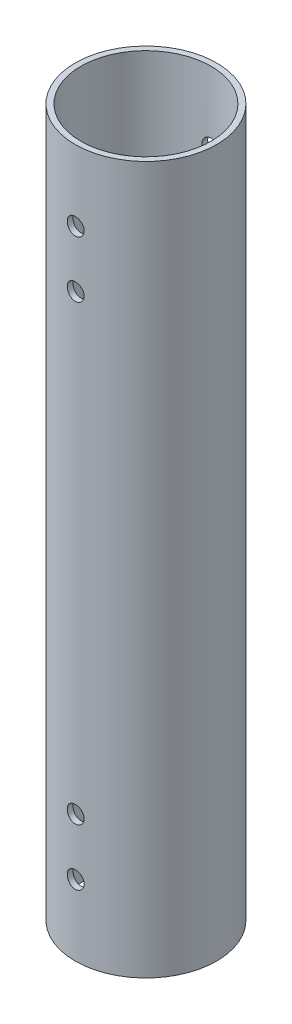
from build123d import *

# Parameters (mm, degrees)
SKETCH_1_R               = 25
SKETCH_1_R_2             = 23
EXTRUDE_1_DEPTH          = 250
CUT_EXTRUDE_1_DEPTH      = 253.487623459
CUT_EXTRUDE_1_DEPTH_BACK = 253.487623459
SKETCH_2_R               = 3


with BuildPart() as part:
    # 草图1 → 凸台-拉伸1 (new body)
    with BuildSketch(Plane(origin=(0, 0, 0), x_dir=(1, 0, 0), z_dir=(0, 1, 0))):
        with Locations(Location((0, 0, 0), (0, 0, 270))):
            Circle(SKETCH_1_R)
        with Locations(Location((0, 0, 0), (0, 0, 270))):
            Circle(SKETCH_1_R_2, mode=Mode.SUBTRACT)
    extrude(amount=EXTRUDE_1_DEPTH)

    # 草图2 → 切除-拉伸1 (cut, two sides: drawn at the far end of the back side and taken through both)
    with BuildSketch(Plane.XY.offset(-CUT_EXTRUDE_1_DEPTH_BACK)):
        with Locations((0, 45)):
            Circle(SKETCH_2_R)
        with Locations((0, 25)):
            Circle(SKETCH_2_R)
        with Locations((0, 225)):
            Circle(SKETCH_2_R)
        with Locations((0, 205)):
            Circle(SKETCH_2_R)
    extrude(amount=CUT_EXTRUDE_1_DEPTH + CUT_EXTRUDE_1_DEPTH_BACK, mode=Mode.SUBTRACT)


solid = part.part
